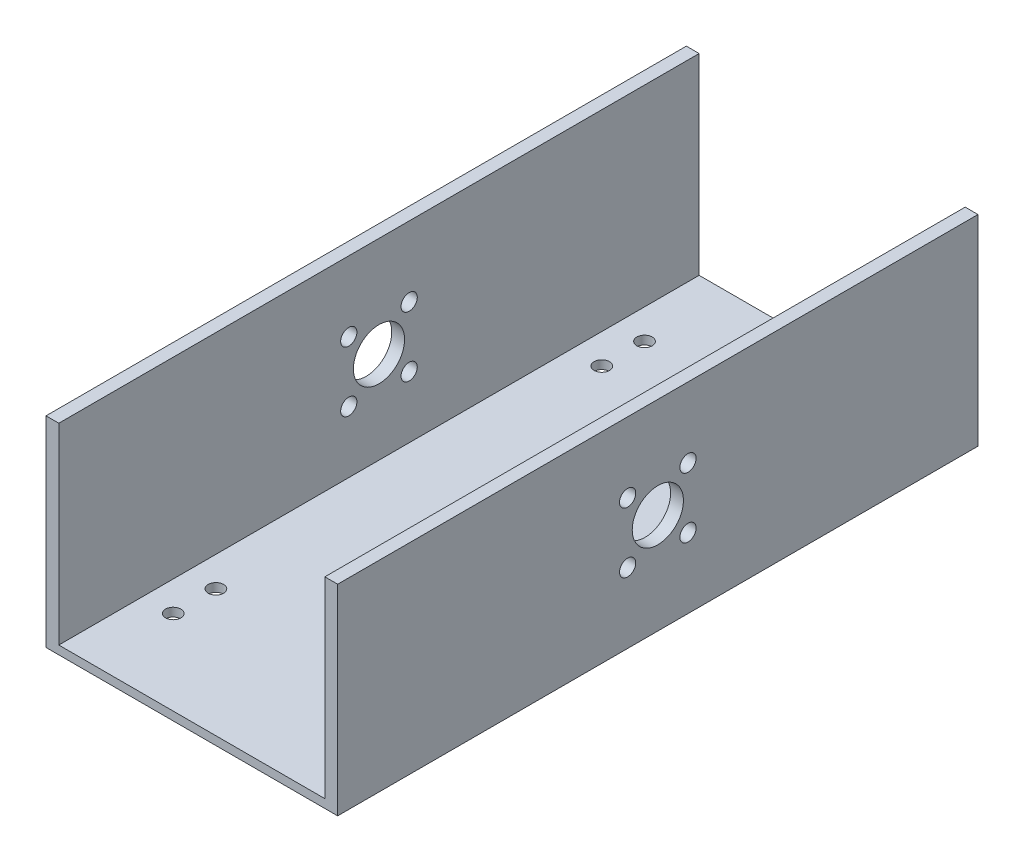
from build123d import *

# Parameters (mm, degrees)
CROQUIS1_W              = 68.32
CROQUIS1_H              = 150
CROQUIS1_R              = 1.8
SALIENTE_EXTRUIR1_DEPTH = 2
CROQUIS2_W              = 3
CROQUIS2_H              = 150
SALIENTE_EXTRUIR2_DEPTH = 45
CROQUIS3_W              = 3
CROQUIS3_H              = 150
SALIENTE_EXTRUIR3_DEPTH = 45
CROQUIS4_R              = 6
CROQUIS4_R_2            = 1.9
CORTAR_EXTRUIR1_DEPTH   = 112.810654233
MATRIZC1_COUNT          = 4


with BuildPart() as part:
    # Croquis1 → Saliente-Extruir1 (new body)
    with BuildSketch(Plane(origin=(0, 0, 0), x_dir=(1, 0, 0), z_dir=(0, 1, 0))):
        Rectangle(CROQUIS1_W, CROQUIS1_H)
        with Locations(Location((24.16, 45.2, 0), (0, 0, 270))):
            Circle(CROQUIS1_R, mode=Mode.SUBTRACT)
        with Locations(Location((24.16, 55.2, 0), (0, 0, 270))):
            Circle(CROQUIS1_R, mode=Mode.SUBTRACT)
        with Locations(Location((-24.16, -55.2, 0), (0, 0, 90))):
            Circle(CROQUIS1_R, mode=Mode.SUBTRACT)
        with Locations(Location((24.16, -55.2, 0), (0, 0, 90))):
            Circle(CROQUIS1_R, mode=Mode.SUBTRACT)
        with Locations(Location((-24.16, 45.2, 0), (0, 0, 270))):
            Circle(CROQUIS1_R, mode=Mode.SUBTRACT)
        with Locations(Location((-24.16, 55.2, 0), (0, 0, 270))):
            Circle(CROQUIS1_R, mode=Mode.SUBTRACT)
        with Locations(Location((-24.16, -45.2, 0), (0, 0, 90))):
            Circle(CROQUIS1_R, mode=Mode.SUBTRACT)
        with Locations(Location((24.16, -45.2, 0), (0, 0, 90))):
            Circle(CROQUIS1_R, mode=Mode.SUBTRACT)
    extrude(amount=SALIENTE_EXTRUIR1_DEPTH)

    # Croquis2 → Saliente-Extruir2 (add)
    with BuildSketch(Plane(origin=(0, 2, 0), x_dir=(1, 0, 0), z_dir=(0, 1, 0))):
        with Locations((-32.66, 0)):
            Rectangle(CROQUIS2_W, CROQUIS2_H)
    extrude(amount=SALIENTE_EXTRUIR2_DEPTH)

    # Croquis3 → Saliente-Extruir3 (add)
    with BuildSketch(Plane(origin=(0, 2, 0), x_dir=(1, 0, 0), z_dir=(0, 1, 0))):
        with Locations((32.66, 0)):
            Rectangle(CROQUIS3_W, CROQUIS3_H)
    extrude(amount=SALIENTE_EXTRUIR3_DEPTH)

    # Croquis4 → Cortar-Extruir1 (cut, through all)
    with BuildSketch(Plane.ZY.offset(34.16)):
        with Locations((0, 23.5)):
            Circle(CROQUIS4_R)
        with Locations((7.071067812, 30.571067812)):
            Circle(CROQUIS4_R_2)
    cortar_extruir1 = extrude(amount=-CORTAR_EXTRUIR1_DEPTH, mode=Mode.SUBTRACT)

    # MatrizC1: Cortar-Extruir1 ×4 about axis
    matrizc1_axis = Axis((0, 23.5, 0), (1, 0, 0))
    for i in range(1, MATRIZC1_COUNT):
        add(cortar_extruir1.rotate(matrizc1_axis, i * 360 / MATRIZC1_COUNT), mode=Mode.SUBTRACT)


solid = part.part
